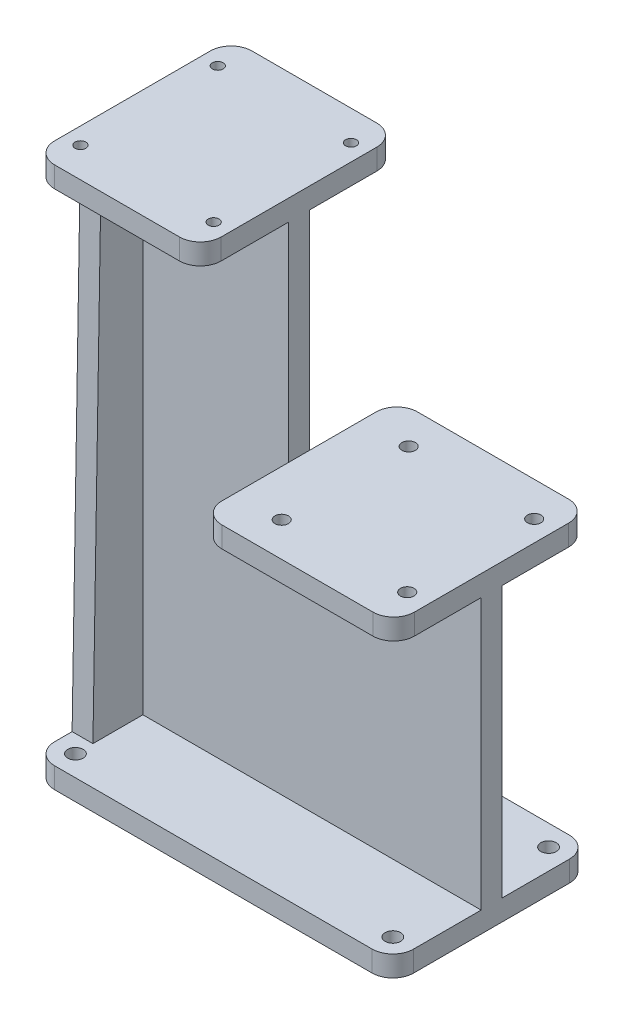
from build123d import *

# Parameters (mm, degrees)
SKT_BASE_W_MOUNTING_HOLES_R           = 1.85
EXT_BASE_PLATE_W_MOUNTING_HOLES_DEPTH = 5
SKT_UPWARD_RIDGE_W                    = 86.25
SKT_UPWARD_RIDGE_H                    = 5
EXT_UPWARD_FLANGE_DEPTH               = 65
EXT_PIX_PLATFORM_DEPTH                = 5
PIX_MOUNT_HOLES_REACH                 = 91.702
SKETCH7_R                             = 1.625
SKETCH8_W                             = 40
SKETCH8_H                             = 5
GPS_FLANGE_DEPTH                      = 55
SKETCH9_R                             = 1.3
GPS_PLATFORM_DEPTH                    = 5
BRACING_DEPTH                         = 5


with BuildPart() as part:
    # Skt - Base w mounting holes → Ext - Base Plate w Mounting Holes (new body)
    with BuildSketch(Plane(origin=(0, 0, 0), x_dir=(1, 0, 0), z_dir=(0, 1, 0))):
        with BuildLine():
            Line((-38.125, 23.7), (38.125, 23.7))
            ThreePointArc((38.125, 23.7), (41.660533906, 22.235533906), (43.125, 18.7))
            Line((43.125, 18.7), (43.125, -18.7))
            ThreePointArc((43.125, -18.7), (41.660533906, -22.235533906), (38.125, -23.7))
            Line((38.125, -23.7), (-38.125, -23.7))
            ThreePointArc((-38.125, -23.7), (-41.660533906, -22.235533906), (-43.125, -18.7))
            Line((-43.125, -18.7), (-43.125, 18.7))
            ThreePointArc((-43.125, 18.7), (-41.660533906, 22.235533906), (-38.125, 23.7))
        make_face()
        with Locations(Location((-38.125, 18.7, 0), (0, 0, 270))):
            Circle(SKT_BASE_W_MOUNTING_HOLES_R, mode=Mode.SUBTRACT)
        with Locations(Location((38.125, 18.7, 0), (0, 0, 270))):
            Circle(SKT_BASE_W_MOUNTING_HOLES_R, mode=Mode.SUBTRACT)
        with Locations(Location((38.125, -18.7, 0), (0, 0, 270))):
            Circle(SKT_BASE_W_MOUNTING_HOLES_R, mode=Mode.SUBTRACT)
        with Locations(Location((-38.125, -18.7, 0), (0, 0, 270))):
            Circle(SKT_BASE_W_MOUNTING_HOLES_R, mode=Mode.SUBTRACT)
    extrude(amount=EXT_BASE_PLATE_W_MOUNTING_HOLES_DEPTH)

    # Skt - Upward Ridge → Ext - Upward Flange (add)
    with BuildSketch(Plane(origin=(0, 5, 0), x_dir=(1, 0, 0), z_dir=(0, 1, 0))):
        Rectangle(SKT_UPWARD_RIDGE_W, SKT_UPWARD_RIDGE_H)
    extrude(amount=EXT_UPWARD_FLANGE_DEPTH)

    # Skt - GPS Nest → Ext - PIX Platform (add)
    with BuildSketch(Plane(origin=(0, 70, 0), x_dir=(1, 0, 0), z_dir=(0, 1, 0))):
        with BuildLine():
            Line((1.875, 23.5), (38.125, 23.5))
            ThreePointArc((38.125, 23.5), (41.660533906, 22.035533906), (43.125, 18.5))
            Line((43.125, 18.5), (43.125, -18.5))
            ThreePointArc((43.125, -18.5), (41.660533906, -22.035533906), (38.125, -23.5))
            Line((38.125, -23.5), (1.875, -23.5))
            ThreePointArc((1.875, -23.5), (-1.660533906, -22.035533906), (-3.125, -18.5))
            Line((-3.125, -18.5), (-3.125, 18.5))
            ThreePointArc((-3.125, 18.5), (-1.660533906, 22.035533906), (1.875, 23.5))
        make_face()
    extrude(amount=EXT_PIX_PLATFORM_DEPTH)

    # Sketch7 → Pix Mount Holes (cut, up to next)
    with BuildSketch(Plane(origin=(0, 75, 0), x_dir=(1, 0, 0), z_dir=(0, 1, 0)), mode=Mode.PRIVATE) as pix_mount_holes_sk1:
        with Locations(Location((7.975, 15.25, 0), (0, 0, 270))):
            Circle(SKETCH7_R)
    pix_mount_holes_tool1 = extrude(pix_mount_holes_sk1.sketch, amount=-PIX_MOUNT_HOLES_REACH, mode=Mode.PRIVATE) & part.part
    # Sketch7 → Pix Mount Holes (cut, up to next)
    with BuildSketch(Plane(origin=(0, 75, 0), x_dir=(1, 0, 0), z_dir=(0, 1, 0)), mode=Mode.PRIVATE) as pix_mount_holes_sk2:
        with Locations(Location((38.125, 15.25, 0), (0, 0, 270))):
            Circle(SKETCH7_R)
    pix_mount_holes_tool2 = extrude(pix_mount_holes_sk2.sketch, amount=-PIX_MOUNT_HOLES_REACH, mode=Mode.PRIVATE) & part.part
    # Sketch7 → Pix Mount Holes (cut, up to next)
    with BuildSketch(Plane(origin=(0, 75, 0), x_dir=(1, 0, 0), z_dir=(0, 1, 0)), mode=Mode.PRIVATE) as pix_mount_holes_sk3:
        with Locations(Location((38.125, -15.25, 0), (0, 0, 270))):
            Circle(SKETCH7_R)
    pix_mount_holes_tool3 = extrude(pix_mount_holes_sk3.sketch, amount=-PIX_MOUNT_HOLES_REACH, mode=Mode.PRIVATE) & part.part
    # Sketch7 → Pix Mount Holes (cut, up to next)
    with BuildSketch(Plane(origin=(0, 75, 0), x_dir=(1, 0, 0), z_dir=(0, 1, 0)), mode=Mode.PRIVATE) as pix_mount_holes_sk4:
        with Locations(Location((7.975, -15.25, 0), (0, 0, 270))):
            Circle(SKETCH7_R)
    pix_mount_holes_tool4 = extrude(pix_mount_holes_sk4.sketch, amount=-PIX_MOUNT_HOLES_REACH, mode=Mode.PRIVATE) & part.part
    add(pix_mount_holes_tool1.solids().sort_by_distance((7.975, 75, -15.25))[0], mode=Mode.SUBTRACT)
    add(pix_mount_holes_tool2.solids().sort_by_distance((38.125, 75, -15.25))[0], mode=Mode.SUBTRACT)
    add(pix_mount_holes_tool3.solids().sort_by_distance((38.125, 75, 15.25))[0], mode=Mode.SUBTRACT)
    add(pix_mount_holes_tool4.solids().sort_by_distance((7.975, 75, 15.25))[0], mode=Mode.SUBTRACT)

    # Sketch8 → GPS Flange (add)
    with BuildSketch(Plane(origin=(0, 70, 0), x_dir=(1, 0, 0), z_dir=(0, 1, 0))):
        with Locations((-23.125, 0)):
            Rectangle(SKETCH8_W, SKETCH8_H)
    extrude(amount=GPS_FLANGE_DEPTH)

    # Sketch9 → GPS Platform (add)
    with BuildSketch(Plane(origin=(0, 125, 0), x_dir=(1, 0, 0), z_dir=(0, 1, 0))):
        with BuildLine():
            Line((-38.125, 23.7), (-8.125, 23.7))
            ThreePointArc((-8.125, 23.7), (-4.589466094, 22.235533906), (-3.125, 18.7))
            Line((-3.125, 18.7), (-3.125, -18.7))
            ThreePointArc((-3.125, -18.7), (-4.589466094, -22.235533906), (-8.125, -23.7))
            Line((-8.125, -23.7), (-38.125, -23.7))
            ThreePointArc((-38.125, -23.7), (-41.660533906, -22.235533906), (-43.125, -18.7))
            Line((-43.125, -18.7), (-43.125, 18.7))
            ThreePointArc((-43.125, 18.7), (-41.660533906, 22.235533906), (-38.125, 23.7))
        make_face()
        with Locations(Location((-39.125, 16.5, 0), (0, 0, 270))):
            Circle(SKETCH9_R, mode=Mode.SUBTRACT)
        with Locations(Location((-7.125, 16.5, 0), (0, 0, 270))):
            Circle(SKETCH9_R, mode=Mode.SUBTRACT)
        with Locations(Location((-7.125, -16.5, 0), (0, 0, 270))):
            Circle(SKETCH9_R, mode=Mode.SUBTRACT)
        with Locations(Location((-39.125, -16.5, 0), (0, 0, 270))):
            Circle(SKETCH9_R, mode=Mode.SUBTRACT)
    extrude(amount=GPS_PLATFORM_DEPTH)

    # Sketch10 → Bracing (add)
    with BuildSketch(Plane.ZY.offset(43.125)):
        Polygon((-2.5, 5), (-2.5, 125), (-12.5, 125), (-14.5, 5), align=None)
        Polygon((2.5, 125), (2.5, 5), (14.5, 5), (12.5, 125), align=None)
    extrude(amount=-BRACING_DEPTH)


solid = part.part
